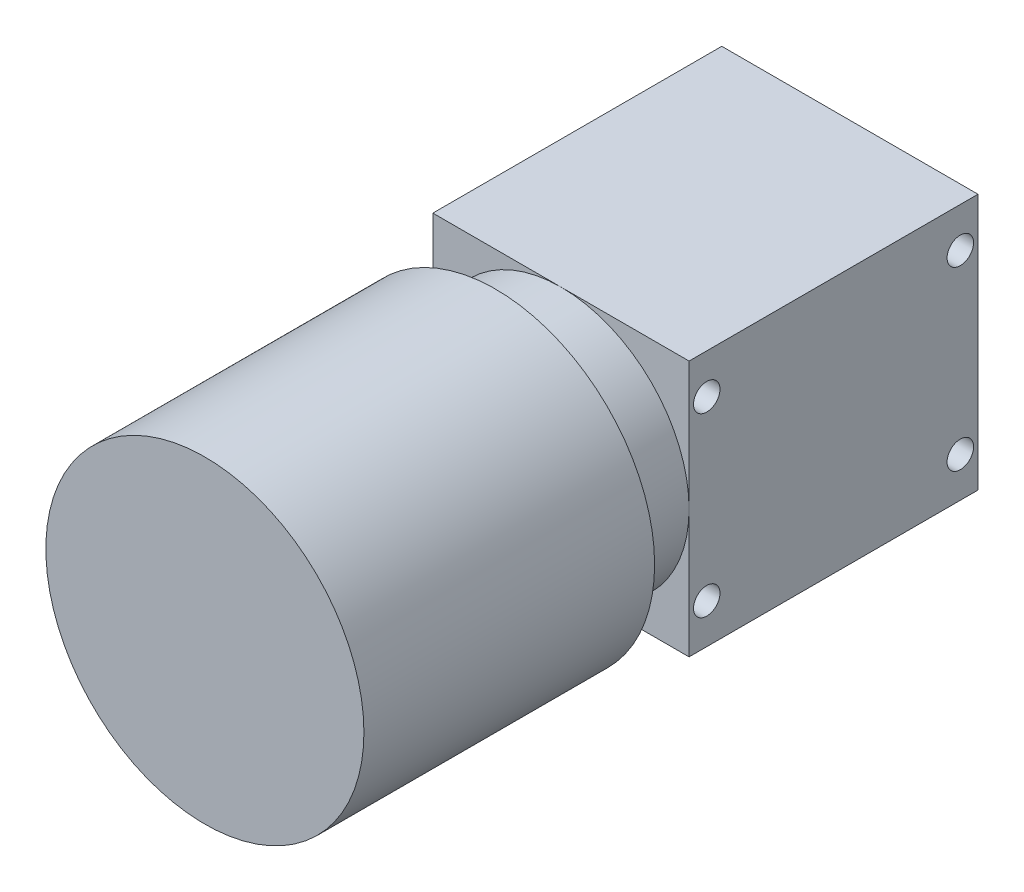
from build123d import *

# Parameters (mm, degrees)
SKETCH_1_W          = 29
SKETCH_1_H          = 29
EXTRUDE_1_DEPTH     = 32.7
SKETCH_2_R          = 14.5
SKETCH_2_R_2        = 12.995867769
EXTRUDE_2_DEPTH     = 7.4
SKETCH_3_R          = 1.5
CUT_EXTRUDE_1_DEPTH = 42.4
SKETCH_4_R          = 18
EXTRUDE_3_DEPTH     = 32.9


with BuildPart() as part:
    # 草图1 → 凸台-拉伸1 (new body)
    with BuildSketch(Plane.XY):
        Rectangle(SKETCH_1_W, SKETCH_1_H)
    extrude(amount=EXTRUDE_1_DEPTH)

    # 草图2 → 凸台-拉伸2 (add)
    with BuildSketch(Plane.XY.offset(32.7)):
        Circle(SKETCH_2_R)
        Circle(SKETCH_2_R_2, mode=Mode.SUBTRACT)
    extrude(amount=EXTRUDE_2_DEPTH)

    # 草图3 → 切除-拉伸1 (cut)
    with BuildSketch(Plane.ZY.offset(14.5)):
        with Locations(Location((2, 10, 0), (0, 0, 270))):
            Circle(SKETCH_3_R)
        with Locations(Location((30.7, 10, 0), (0, 0, 270))):
            Circle(SKETCH_3_R)
        with Locations(Location((30.7, -10, 0), (0, 0, 270))):
            Circle(SKETCH_3_R)
        with Locations(Location((2, -10, 0), (0, 0, 270))):
            Circle(SKETCH_3_R)
    extrude(amount=-CUT_EXTRUDE_1_DEPTH, mode=Mode.SUBTRACT)

    # 草图4 → 凸台-拉伸3 (add)
    with BuildSketch(Plane.XY.offset(40.1)):
        Circle(SKETCH_4_R)
    extrude(amount=EXTRUDE_3_DEPTH)


solid = part.part
